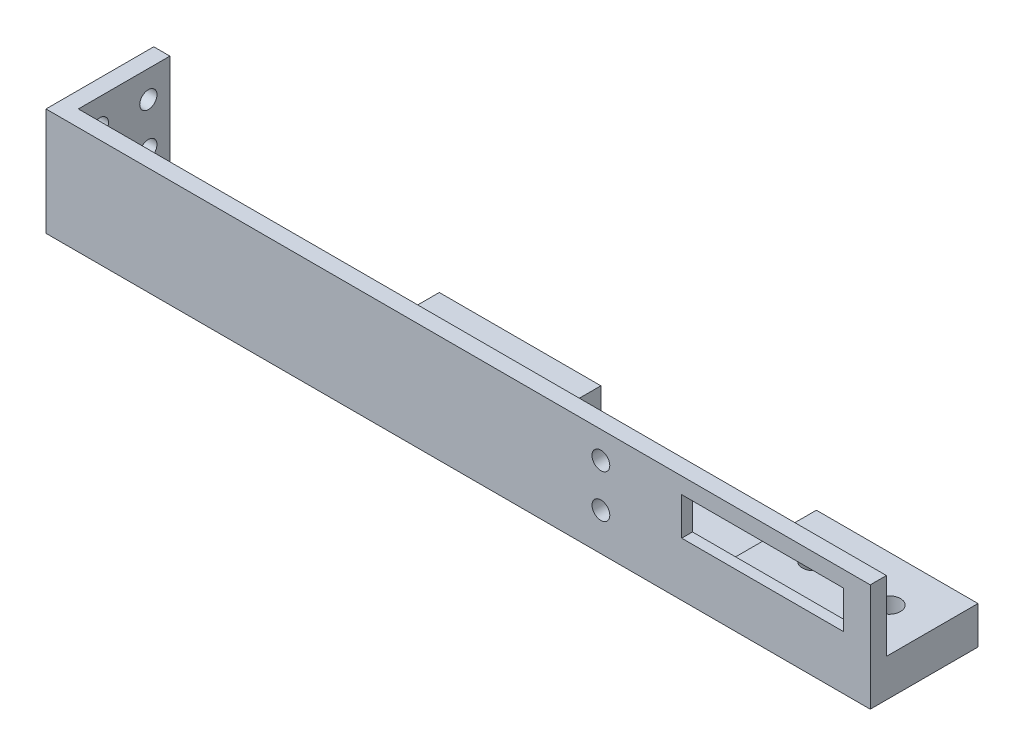
from build123d import *

# Parameters (mm, degrees)
SKETCH1_W           = 153
SKETCH1_H           = 20
BOSS_EXTRUDE1_DEPTH = 3
SKETCH2_W           = 3
SKETCH2_H           = 20
BOSS_EXTRUDE2_DEPTH = 17
SKETCH3_W           = 150
SKETCH3_H           = 3
BOSS_EXTRUDE3_DEPTH = 17
SKETCH4_R           = 1.6
SKETCH4_R_2         = 1.598435099
CUT_EXTRUDE1_DEPTH  = 10
SKETCH6_W           = 30
SKETCH6_H           = 17
BOSS_EXTRUDE4_DEPTH = 4
SKETCH7_R           = 2.1
CUT_EXTRUDE3_DEPTH  = 243.348358538
SKETCH8_R           = 4
CUT_EXTRUDE4_DEPTH  = 2.5
SKETCH9_W           = 30
SKETCH9_H           = 17
BOSS_EXTRUDE5_DEPTH = 4
SKETCH12_R          = 2.1
CUT_EXTRUDE7_DEPTH  = 243.348358538
SKETCH13_R          = 4
CUT_EXTRUDE8_DEPTH  = 2.5
SKETCH14_W          = 30
SKETCH14_H          = 7
CUT_EXTRUDE9_DEPTH  = 3
CHAMFER8_SIZE       = 1
CHAMFER9_SIZE       = 3
SKETCH15_W          = 3.1
SKETCH15_H          = 17
CUT_EXTRUDE10_DEPTH = 3
SKETCH16_R          = 1.65
CUT_EXTRUDE11_DEPTH = 3
SKETCH17_R          = 3
CUT_EXTRUDE12_DEPTH = 6


with BuildPart() as part:
    # Sketch1 → Boss-Extrude1 (new body)
    with BuildSketch(Plane.XY):
        with Locations((164.901588409, -32.175360178)):
            Rectangle(SKETCH1_W, SKETCH1_H)
    extrude(amount=BOSS_EXTRUDE1_DEPTH)

    # Sketch2 → Boss-Extrude2 (add)
    with BuildSketch(Plane(origin=(0, 0, 0), x_dir=(-1, 0, 0), z_dir=(0, 0, -1))):
        with Locations((-89.901588409, -32.175360178)):
            Rectangle(SKETCH2_W, SKETCH2_H)
    extrude(amount=BOSS_EXTRUDE2_DEPTH)

    # Sketch3 → Boss-Extrude3 (add)
    with BuildSketch(Plane(origin=(0, 0, 0), x_dir=(-1, 0, 0), z_dir=(0, 0, -1))):
        with Locations((-166.401588409, -40.675360178)):
            Rectangle(SKETCH3_W, SKETCH3_H)
    extrude(amount=BOSS_EXTRUDE3_DEPTH)

    # Sketch4 → Cut-Extrude1 (cut)
    with BuildSketch(Plane.ZY.offset(-88.401588409)):
        with Locations((-13, -27.175360178)):
            Circle(SKETCH4_R)
        with Locations((-4, -27.175360178)):
            Circle(SKETCH4_R)
        with Locations((-4, -35.175360178)):
            Circle(SKETCH4_R)
        with Locations((-13, -35.175360178)):
            Circle(SKETCH4_R_2)
    extrude(amount=-CUT_EXTRUDE1_DEPTH, mode=Mode.SUBTRACT)

    # Sketch6 → Boss-Extrude4 (add)
    with BuildSketch(Plane(origin=(0, -39.175360178, 0), x_dir=(1, 0, 0), z_dir=(0, 1, 0))):
        with Locations((226.401588409, 8.5)):
            Rectangle(SKETCH6_W, SKETCH6_H)
    extrude(amount=BOSS_EXTRUDE4_DEPTH)

    # Sketch7 → Cut-Extrude3 (cut, through all)
    with BuildSketch(Plane(origin=(0, -35.175360178, 0), x_dir=(1, 0, 0), z_dir=(0, 1, 0))):
        with Locations(Location((219.401588409, 8.5, 0), (0, 0, 270))):
            Circle(SKETCH7_R)
        with Locations(Location((233.401588409, 8.5, 0), (0, 0, 270))):
            Circle(SKETCH7_R)
    extrude(amount=-CUT_EXTRUDE3_DEPTH, mode=Mode.SUBTRACT)

    # Sketch8 → Cut-Extrude4 (cut)
    with BuildSketch(Plane.XZ.offset(42.175360178)):
        with Locations(Location((219.401588409, -8.5, 0), (0, 0, 270))):
            Circle(SKETCH8_R)
        with Locations(Location((233.401588409, -8.5, 0), (0, 0, 270))):
            Circle(SKETCH8_R)
    extrude(amount=-CUT_EXTRUDE4_DEPTH, mode=Mode.SUBTRACT)

    # Sketch9 → Boss-Extrude5 (add)
    with BuildSketch(Plane(origin=(0, -39.175360178, 0), x_dir=(1, 0, 0), z_dir=(0, 1, 0))):
        with Locations((156.401588409, 8.5)):
            Rectangle(SKETCH9_W, SKETCH9_H)
    extrude(amount=BOSS_EXTRUDE5_DEPTH)

    # Sketch12 → Cut-Extrude7 (cut, through all)
    with BuildSketch(Plane(origin=(0, -35.175360178, 0), x_dir=(1, 0, 0), z_dir=(0, 1, 0))):
        with Locations(Location((163.401588409, 8.5, 0), (0, 0, 270))):
            Circle(SKETCH12_R)
        with Locations(Location((149.401588409, 8.5, 0), (0, 0, 270))):
            Circle(SKETCH12_R)
    extrude(amount=-CUT_EXTRUDE7_DEPTH, mode=Mode.SUBTRACT)

    # Sketch13 → Cut-Extrude8 (cut)
    with BuildSketch(Plane.XZ.offset(42.175360178)):
        with Locations(Location((163.401588409, -8.5, 0), (0, 0, 270))):
            Circle(SKETCH13_R)
        with Locations(Location((149.401588409, -8.5, 0), (0, 0, 270))):
            Circle(SKETCH13_R)
    extrude(amount=-CUT_EXTRUDE8_DEPTH, mode=Mode.SUBTRACT)

    # Sketch14 → Cut-Extrude9 (cut)
    with BuildSketch(Plane.XY.offset(3)):
        with Locations((221.401588409, -28.675360178)):
            Rectangle(SKETCH14_W, SKETCH14_H)
    extrude(amount=-CUT_EXTRUDE9_DEPTH, mode=Mode.SUBTRACT)

    # Chamfer8
    chamfer8_edges = [part.edges().sort_by_distance(p)[0] for p in [
        (236.401588409, -28.675360178, 0),
        (221.401588409, -32.175360178, 0),
        (206.401588409, -28.675360178, 0),
        (221.401588409, -25.175360178, 0),
    ]]
    chamfer(chamfer8_edges, length=CHAMFER8_SIZE)

    # Chamfer9
    chamfer9_edges = [part.edges().sort_by_distance(p)[0] for p in [
        (116.401588409, -39.175360178, 0),
        (191.401588409, -39.175360178, 0),
    ]]
    chamfer(chamfer9_edges, length=CHAMFER9_SIZE)

    # Sketch15 → Cut-Extrude10 (cut)
    with BuildSketch(Plane(origin=(0, -39.175360178, 0), x_dir=(1, 0, 0), z_dir=(0, 1, 0))):
        with Locations((209.851588409, 8.5)):
            Rectangle(SKETCH15_W, SKETCH15_H)
        with Locations((172.951588409, 8.5)):
            Rectangle(SKETCH15_W, SKETCH15_H)
        with Locations((139.851588409, 8.5)):
            Rectangle(SKETCH15_W, SKETCH15_H)
    extrude(amount=CUT_EXTRUDE10_DEPTH, mode=Mode.SUBTRACT)

    # Sketch16 → Cut-Extrude11 (cut)
    with BuildSketch(Plane(origin=(0, 0, 0), x_dir=(-1, 0, 0), z_dir=(0, 0, -1))):
        with Locations((-191.401588409, -27.175360178)):
            Circle(SKETCH16_R)
        with Locations(Location((-191.401588409, -35.175360178, 0), (0, 0, 322.694799034))):
            Circle(SKETCH16_R)
    extrude(amount=-CUT_EXTRUDE11_DEPTH, mode=Mode.SUBTRACT)

    # Sketch17 → Cut-Extrude12 (cut)
    with BuildSketch(Plane(origin=(0, 0, 0), x_dir=(-1, 0, 0), z_dir=(0, 0, -1))):
        with Locations((-191.401588409, -35.175360178)):
            Circle(SKETCH17_R)
    extrude(amount=CUT_EXTRUDE12_DEPTH, mode=Mode.SUBTRACT)


solid = part.part
